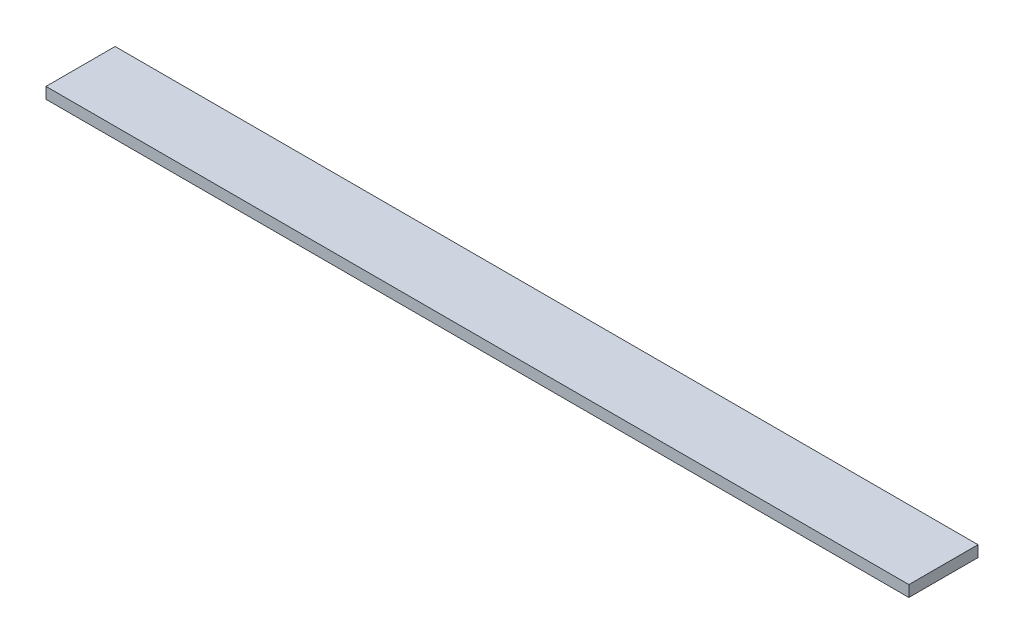
from build123d import *

# Parameters (mm, degrees)
SKETCH1_W           = 2933.7
SKETCH1_H           = 234.95
BOSS_EXTRUDE1_DEPTH = 38.1


with BuildPart() as part:
    # Sketch1 → Boss-Extrude1 (new body)
    with BuildSketch(Plane(origin=(0, 0, 0), x_dir=(1, 0, 0), z_dir=(0, 1, 0))):
        with Locations((745.676086957, 304.583695652)):
            Rectangle(SKETCH1_W, SKETCH1_H)
    extrude(amount=BOSS_EXTRUDE1_DEPTH)


solid = part.part
